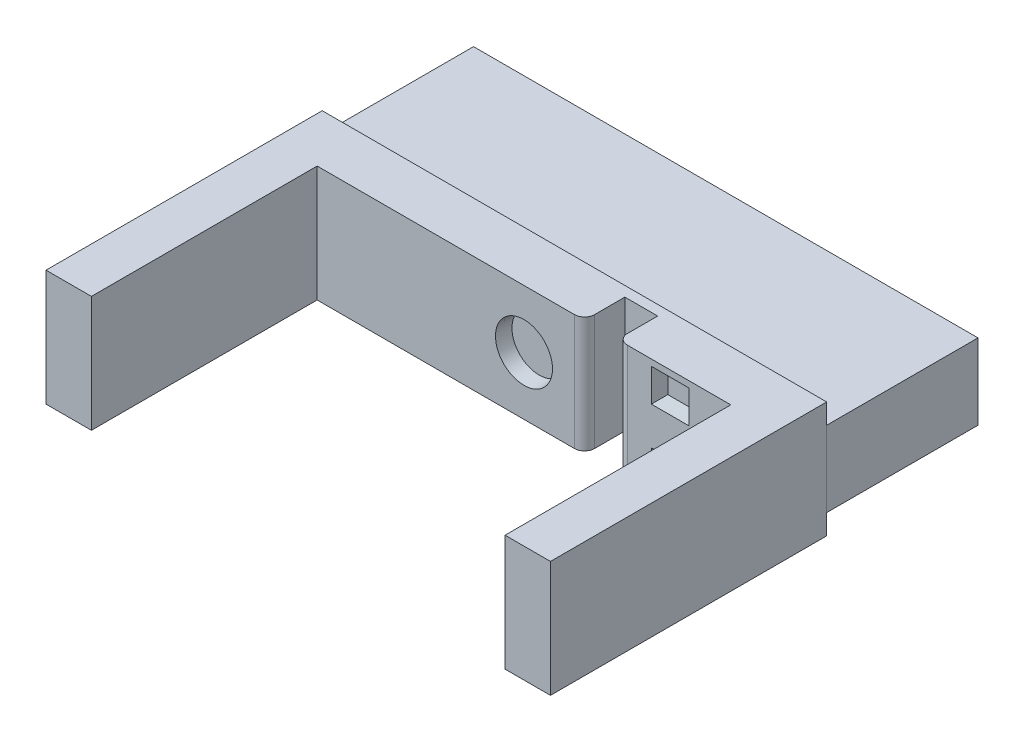
from build123d import *

# Parameters (mm, degrees)
SKETCH1_W                 = 100
SKETCH1_H                 = 15
CARRIAGE_BOTTOM_DEPTH     = 30
SKETCH2_W                 = 100
SKETCH2_H                 = 23
PLEXI_STAND_DEPTH         = 10
SKETCH8_W                 = 6.5
SKETCH8_H                 = 23
HOLE_FOR_WIRES_DEPTH      = 8
FILLET1_R                 = 2
SKETCH9_W                 = 9
SKETCH9_H                 = 23
BRACKET_HOLDERS_DEPTH     = 44.75
SKETCH10_R                = 5.65
FIT_HOLES_DEPTH           = 3
FIT_HOLES_DRAFT           = -5
SKETCH10_W                = 7.5
SKETCH10_H                = 6.5
FIT_HOLES_PROFILE_2_DEPTH = 3
FIT_HOLES_PROFILE_2_DRAFT = -5
FIT_HOLES_PROFILE_3_DEPTH = 3
FIT_HOLES_PROFILE_3_DRAFT = -5


with BuildPart() as part:
    # Sketch1 → carriage bottom (new body)
    with BuildSketch(Plane.XY):
        with Locations((50, -7.5)):
            Rectangle(SKETCH1_W, SKETCH1_H)
    extrude(amount=CARRIAGE_BOTTOM_DEPTH)


with BuildPart() as body_2:
    # Sketch2 → plexi stand (new body)
    with BuildSketch(Plane.XY.offset(30)):
        with Locations((50, -7.5)):
            Rectangle(SKETCH2_W, SKETCH2_H)
    extrude(amount=PLEXI_STAND_DEPTH)

    # Sketch8 → hole for wires (cut)
    with BuildSketch(Plane.XY.offset(40)):
        with Locations((65.25, -7.5)):
            Rectangle(SKETCH8_W, SKETCH8_H)
    extrude(amount=-HOLE_FOR_WIRES_DEPTH, mode=Mode.SUBTRACT)

    # Fillet1
    fillet1_edges = [body_2.edges().sort_by_distance(p)[0] for p in [
        (68.5, -7.5, 40),
        (62, -7.5, 40),
    ]]
    fillet(fillet1_edges, radius=FILLET1_R)

    # Sketch9 → bracket holders (add)
    with BuildSketch(Plane.XY.offset(40)):
        with Locations((95.5, -7.5)):
            Rectangle(SKETCH9_W, SKETCH9_H)
        with Locations((4.5, -7.5)):
            Rectangle(SKETCH9_W, SKETCH9_H)
    extrude(amount=BRACKET_HOLDERS_DEPTH)


with BuildPart() as fit_holes_tool:
    # Sketch10 → fit holes (with draft: the straight prism first)
    with BuildSketch(Plane.XY.offset(40)):
        with Locations((50, -7.5)):
            Circle(SKETCH10_R)
    extrude(amount=-FIT_HOLES_DEPTH)
    # fit holes: the draft: its side faces are tilted about the plane it starts from
    fit_holes_sides = [fit_holes_tool.faces().sort_by_distance(p)[0] for p in [
        (44.35, -7.5, 38.5),
    ]]
    draft(fit_holes_sides, Plane.XY.offset(40), FIT_HOLES_DRAFT)


with BuildPart() as body_2_1:
    add(body_2.part)

    # fit holes: cut by fit_holes_tool
    add(fit_holes_tool.part, mode=Mode.SUBTRACT)


with BuildPart() as fit_holes_profile_2_tool:
    # Sketch10 → fit holes profile 2 (with draft: the straight prism first)
    with BuildSketch(Plane.XY.offset(40)):
        with Locations((79, -14.5)):
            Rectangle(SKETCH10_W, SKETCH10_H)
    extrude(amount=-FIT_HOLES_PROFILE_2_DEPTH)
    # fit holes profile 2: the draft: its side faces are tilted about the plane it starts from
    fit_holes_profile_2_sides = [fit_holes_profile_2_tool.faces().sort_by_distance(p)[0] for p in [
        (79, -17.75, 38.5),
        (82.75, -14.5, 38.5),
        (79, -11.25, 38.5),
        (75.25, -14.5, 38.5),
    ]]
    draft(fit_holes_profile_2_sides, Plane.XY.offset(40), FIT_HOLES_PROFILE_2_DRAFT)


with BuildPart() as body_2_2:
    add(body_2_1.part)

    # fit holes profile 2: cut by fit_holes_profile_2_tool
    add(fit_holes_profile_2_tool.part, mode=Mode.SUBTRACT)


with BuildPart() as fit_holes_profile_3_tool:
    # Sketch10 → fit holes profile 3 (with draft: the straight prism first)
    with BuildSketch(Plane.XY.offset(40)):
        with Locations((79, -0.5)):
            Rectangle(SKETCH10_W, SKETCH10_H)
    extrude(amount=-FIT_HOLES_PROFILE_3_DEPTH)
    # fit holes profile 3: the draft: its side faces are tilted about the plane it starts from
    fit_holes_profile_3_sides = [fit_holes_profile_3_tool.faces().sort_by_distance(p)[0] for p in [
        (79, -3.75, 38.5),
        (82.75, -0.5, 38.5),
        (79, 2.75, 38.5),
        (75.25, -0.5, 38.5),
    ]]
    draft(fit_holes_profile_3_sides, Plane.XY.offset(40), FIT_HOLES_PROFILE_3_DRAFT)


with BuildPart() as body_2_3:
    add(body_2_2.part)

    # fit holes profile 3: cut by fit_holes_profile_3_tool
    add(fit_holes_profile_3_tool.part, mode=Mode.SUBTRACT)


solid = Compound([part.part, body_2_3.part])
